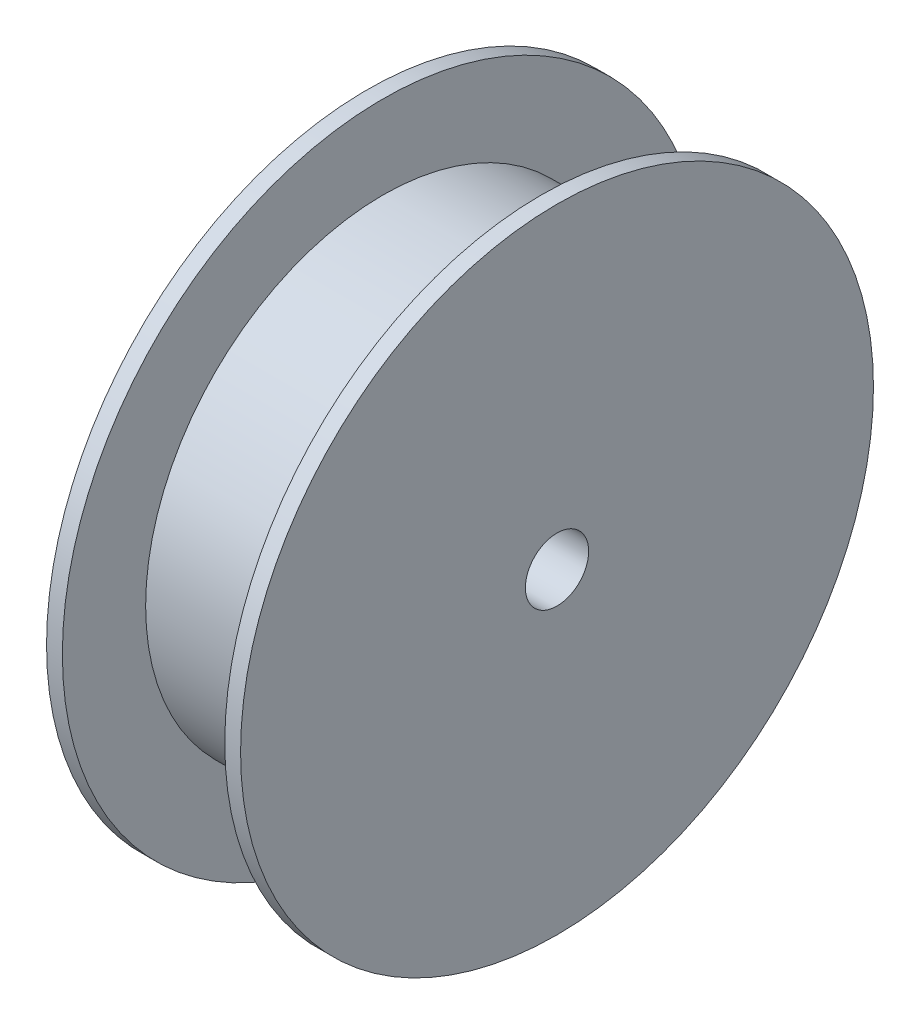
from build123d import *

# Parameters (mm, degrees)
ESQUISSE2_R             = 2
ENL_V_MAT_EXTRU_1_DEPTH = 32.06752542


with BuildPart() as part:
    # Esquisse1 → Révolution1 (revolve)
    with BuildSketch(Plane.XY, mode=Mode.PRIVATE) as r_volution1_sk:
        Polygon((0, 0), (5.5, 0), (5.5, 20), (4.5, 20), (4.5, 15), (-5.5, 15), (-5.5, 20.263157895), (-6.5, 20.263157895), (-6.5, 0), align=None)
    revolve(r_volution1_sk.sketch.rotate(Axis((-6.5, 0, 0), (1, 0, 0)), 90), axis=Axis((-6.5, 0, 0), (1, 0, 0)))

    # Esquisse2 → Enlèv. mat.-Extru.1 (cut, through all)
    with BuildSketch(Plane(origin=(5.5, 0, 0), x_dir=(0, 0, -1), z_dir=(1, 0, 0))):
        Circle(ESQUISSE2_R)
    extrude(amount=-ENL_V_MAT_EXTRU_1_DEPTH, mode=Mode.SUBTRACT)


solid = part.part
